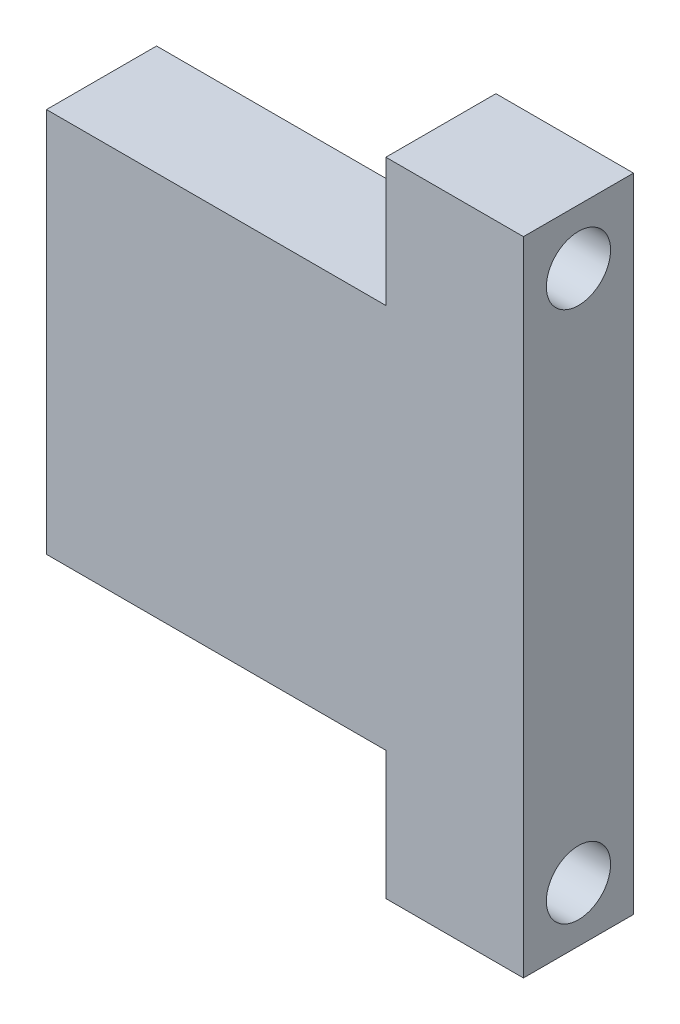
from build123d import *

# Parameters (mm, degrees)
SKETCH1_W                    = 52
SKETCH1_H                    = 70
BOSS_EXTRUDE1_DEPTH          = 12
SKETCH2_W                    = 37
SKETCH2_H                    = 14
CUT_EXTRUDE1_DEPTH           = 64.820059542
F_7_0_7_DIAMETER_HOLE1_D     = 7
F_7_0_7_DIAMETER_HOLE1_DEPTH = 60
F_7_0_7_DIAMETER_HOLE1_TIP   = 2.103012167
M6X1_0_TAPPED_HOLE1_D        = 5
M6X1_0_TAPPED_HOLE1_DEPTH    = 18
M6X1_0_TAPPED_HOLE1_TIP      = 1.502151548


with BuildPart() as part:
    # Sketch1 → Boss-Extrude1 (new body)
    with BuildSketch(Plane.XY):
        with Locations((-26, 0)):
            Rectangle(SKETCH1_W, SKETCH1_H)
    extrude(amount=-BOSS_EXTRUDE1_DEPTH)

    # Sketch2 → Cut-Extrude1 (cut, through all)
    with BuildSketch(Plane.XY):
        with Locations((-33.5, 28)):
            Rectangle(SKETCH2_W, SKETCH2_H)
        with Locations((-33.5, -28)):
            Rectangle(SKETCH2_W, SKETCH2_H)
    extrude(amount=-CUT_EXTRUDE1_DEPTH, mode=Mode.SUBTRACT)

    # Ø7.0 (7) Diameter Hole1
    with Locations(Plane.ZY.offset(15)):
        with Locations((-6, 29), (-6, -29)):
            Hole(F_7_0_7_DIAMETER_HOLE1_D / 2, depth=F_7_0_7_DIAMETER_HOLE1_DEPTH)
            with Locations((0, 0, -(F_7_0_7_DIAMETER_HOLE1_DEPTH + F_7_0_7_DIAMETER_HOLE1_TIP / 2))):  # 118° drill point
                Cone(0, F_7_0_7_DIAMETER_HOLE1_D / 2, F_7_0_7_DIAMETER_HOLE1_TIP, mode=Mode.SUBTRACT)

    # M6x1.0 Tapped Hole1
    with Locations(Plane.ZY.offset(52)):
        with Locations((-6, 14), (-6, -14)):
            Hole(M6X1_0_TAPPED_HOLE1_D / 2, depth=M6X1_0_TAPPED_HOLE1_DEPTH)
            with Locations((0, 0, -(M6X1_0_TAPPED_HOLE1_DEPTH + M6X1_0_TAPPED_HOLE1_TIP / 2))):  # 118° drill point
                Cone(0, M6X1_0_TAPPED_HOLE1_D / 2, M6X1_0_TAPPED_HOLE1_TIP, mode=Mode.SUBTRACT)


solid = part.part
